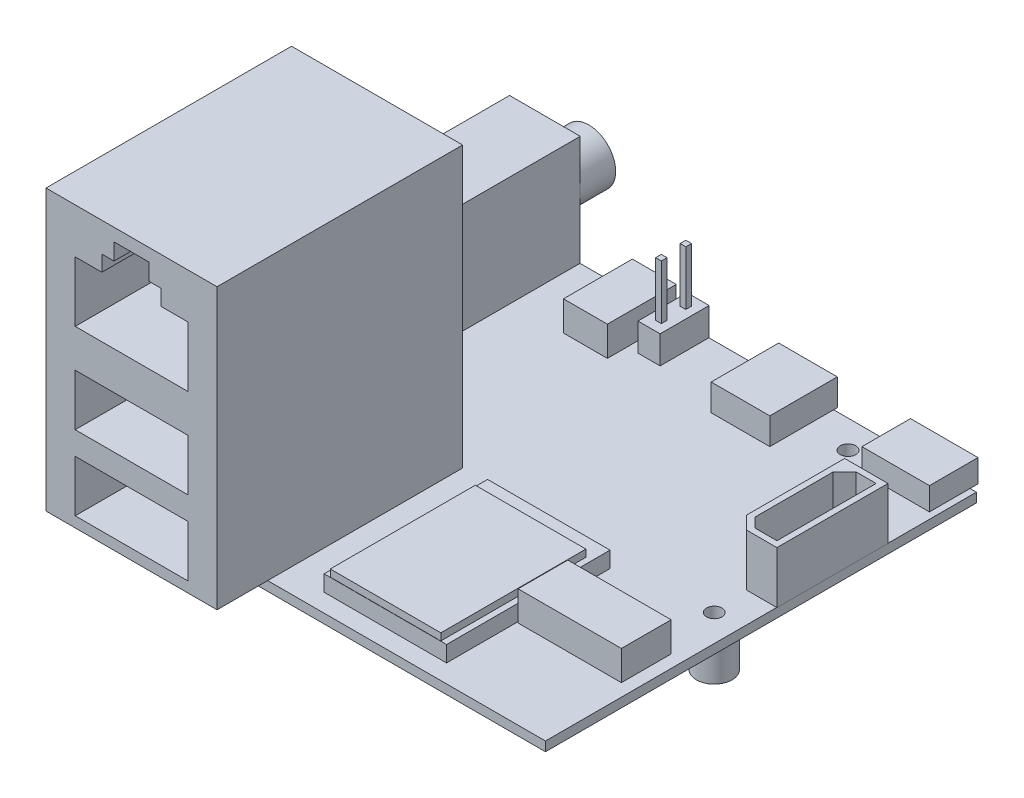
from build123d import *

# Parameters (mm, degrees)
SKETCH1_W                   = 52
SKETCH1_H                   = 48
BASE_DEPTH                  = 1.04
SKETCH3_W                   = 19.05
SKETCH3_H                   = 27.35
ETHERNET_USB_LINKPP_DEPTH   = 31.1658
SKETCH4_W                   = 12.5476
SKETCH4_H                   = 5.7404
USB_PORTS_DEPTH             = 8.89
ETHERNET_PORT_DEPTH         = 11.4681
SKETCH6_W                   = 7.874
SKETCH6_H                   = 13.97
HEADPHONE_JACK_DEPTH        = 12.2428
SKETCH7_R                   = 2.9972
SKETCH7_R_2                 = 1.7653
HEADPHONE_JACK_CIRCLE_DEPTH = 3.9751
SKETCH8_W                   = 4.8895
SKETCH8_H                   = 7.6708
DC_POWER_DEPTH              = 3.302
SKETCH9_R                   = 1.25
DC_POWER_HOLE_DEPTH         = 5.842
SKETCH10_R                  = 0.4
DC_POWER_PIN_DEPTH          = 4.1656
SKETCH11_W                  = 2.4638
SKETCH11_H                  = 5.461
PWM_PIN_BASE_DEPTH          = 3.0988
SKETCH12_W                  = 0.635
SKETCH12_H                  = 0.635
PWM_PINS_DEPTH              = 6.0452
SKETCH13_W                  = 6.5278
SKETCH13_H                  = 7.5184
MICRO_HDMI_PORT_DEPTH       = 2.9718
SKETCH14_W                  = 7.5184
SKETCH14_H                  = 5.4102
MICRO_USB_PORT_DEPTH        = 2.54
HEADER_HOLE_REACH           = 82.266
SKETCH15_R                  = 0.8636
SKETCH16_R                  = 1.9939
STANDOFFS_1_DEPTH           = 4.4704
SKETCH17_R                  = 1.9939
SHORT_STANDOFF_DEPTH        = 1.9939
THREADS_IN_STANDOFFS_REACH  = 82.266
SKETCH19_R                  = 0.8636
SKETCH20_W                  = 12.1158
SKETCH20_H                  = 12.1158
CPU_DEPTH                   = 1.4732
UART_PLASTIC_DEPTH          = 5.7912
UART_HOLE_DEPTH             = 4.1656
SKETCH23_W                  = 11.5062
SKETCH23_H                  = 5.5372
MICROSD_DEPTH               = 3.302
SKETCH24_W                  = 13.6398
SKETCH24_H                  = 18.2118
EMMC_BOARD_DEPTH            = 1.778
SKETCH25_W                  = 12.319
SKETCH25_H                  = 16.1544
EMMC_CHIP_DEPTH             = 0.7874


with BuildPart() as part:
    # Sketch1 → Base (new body)
    with BuildSketch(Plane(origin=(0, 0, 0), x_dir=(1, 0, 0), z_dir=(0, 1, 0))):
        with Locations((26, 24)):
            Rectangle(SKETCH1_W, SKETCH1_H)
    extrude(amount=BASE_DEPTH)

    # Sketch3 → Ethernet-USB-LinkPP (add)
    with BuildSketch(Plane(origin=(0, 1.04, 0), x_dir=(1, 0, 0), z_dir=(0, 1, 0))):
        with Locations((11.5316, 8.0362)):
            Rectangle(SKETCH3_W, SKETCH3_H)
    extrude(amount=ETHERNET_USB_LINKPP_DEPTH)

    # Sketch4 → USB ports (cut)
    with BuildSketch(Plane.XY.offset(5.6388)):
        with Locations((11.5316, 5.0786)):
            Rectangle(SKETCH4_W, SKETCH4_H)
        with Locations((11.5316, 13.3844)):
            Rectangle(SKETCH4_W, SKETCH4_H)
    extrude(amount=-USB_PORTS_DEPTH, mode=Mode.SUBTRACT)

    # Sketch5 → Ethernet port (cut)
    with BuildSketch(Plane.XY.offset(5.6388)):
        Polygon((5.2578, 27.1893), (8.2296, 27.1893), (8.2296, 28.9419), (9.5758, 28.9419), (9.5758, 30.7961), (13.4874, 30.7961), (13.4874, 28.9419), (14.8336, 28.9419), (14.8336, 27.1893), (17.8054, 27.1893), (17.8054, 20.4837), (5.2578, 20.4837), align=None)
    extrude(amount=-ETHERNET_PORT_DEPTH, mode=Mode.SUBTRACT)

    # Sketch6 → Headphone jack (add)
    with BuildSketch(Plane(origin=(0, 1.04, 0), x_dir=(1, 0, 0), z_dir=(0, 1, 0))):
        with Locations((3.9116, 41.0404)):
            Rectangle(SKETCH6_W, SKETCH6_H)
    extrude(amount=HEADPHONE_JACK_DEPTH)

    # Sketch7 → Headphone jack circle (add)
    with BuildSketch(Plane(origin=(0, 0, -48), x_dir=(-1, 0, 0), z_dir=(0, 0, -1))):
        with Locations(Location((-4.8514, 7.9107, 0), (0, 0, 180))):
            Circle(SKETCH7_R)
        with Locations(Location((-4.8514, 7.9107, 0), (0, 0, 180))):
            Circle(SKETCH7_R_2, mode=Mode.SUBTRACT)
    extrude(amount=HEADPHONE_JACK_CIRCLE_DEPTH)

    # Sketch8 → DC power (add)
    with BuildSketch(Plane(origin=(0, 1.04, 0), x_dir=(1, 0, 0), z_dir=(0, 1, 0))):
        with Locations((16.09725, 44.19)):
            Rectangle(SKETCH8_W, SKETCH8_H)
    extrude(amount=DC_POWER_DEPTH)

    # Sketch9 → DC power hole (cut)
    with BuildSketch(Plane(origin=(0, 0, -48.0254), x_dir=(-1, 0, 0), z_dir=(0, 0, -1))):
        with Locations((-16.09725, 2.3154)):
            Circle(SKETCH9_R)
    extrude(amount=-DC_POWER_HOLE_DEPTH, mode=Mode.SUBTRACT)

    # Sketch10 → DC power pin (add)
    with BuildSketch(Plane(origin=(0, 0, -42.1834), x_dir=(-1, 0, 0), z_dir=(0, 0, -1))):
        with Locations((-16.09725, 2.3154)):
            Circle(SKETCH10_R)
    extrude(amount=DC_POWER_PIN_DEPTH)

    # Sketch11 → PWM pin base (add)
    with BuildSketch(Plane(origin=(0, 1.04, 0), x_dir=(1, 0, 0), z_dir=(0, 1, 0))):
        with Locations((20.9739, 45.2949)):
            Rectangle(SKETCH11_W, SKETCH11_H)
    extrude(amount=PWM_PIN_BASE_DEPTH)

    # Sketch12 → PWM pins (add)
    with BuildSketch(Plane(origin=(0, 4.1388, 0), x_dir=(1, 0, 0), z_dir=(0, 1, 0))):
        with Locations((20.9739, 43.92965)):
            Rectangle(SKETCH12_W, SKETCH12_H)
        with Locations((20.9739, 46.66015)):
            Rectangle(SKETCH12_W, SKETCH12_H)
    extrude(amount=PWM_PINS_DEPTH)

    # Sketch13 → Micro HDMI port (add)
    with BuildSketch(Plane(origin=(0, 1.04, 0), x_dir=(1, 0, 0), z_dir=(0, 1, 0))):
        with Locations((32.8357, 44.6472)):
            Rectangle(SKETCH13_W, SKETCH13_H)
    extrude(amount=MICRO_HDMI_PORT_DEPTH)

    # Sketch14 → Micro USB port (add)
    with BuildSketch(Plane(origin=(0, 1.04, 0), x_dir=(1, 0, 0), z_dir=(0, 1, 0))):
        with Locations((47.5296, 46.1839)):
            Rectangle(SKETCH14_W, SKETCH14_H)
    extrude(amount=MICRO_USB_PORT_DEPTH)

    # Sketch15 → Header hole (cut, up to next)
    with BuildSketch(Plane(origin=(0, 0, 0), x_dir=(-1, 0, 0), z_dir=(0, -1, 0)), mode=Mode.PRIVATE) as header_hole_sk1:
        with Locations(Location((-3, 30.1, 0), (0, 0, 90))):
            Circle(SKETCH15_R)
    header_hole_tool1 = extrude(header_hole_sk1.sketch, amount=-HEADER_HOLE_REACH, mode=Mode.PRIVATE) & part.part
    # Sketch15 → Header hole (cut, up to next)
    with BuildSketch(Plane(origin=(0, 0, 0), x_dir=(-1, 0, 0), z_dir=(0, -1, 0)), mode=Mode.PRIVATE) as header_hole_sk2:
        with Locations(Location((-49, 21.8012, 0), (0, 0, 90))):
            Circle(SKETCH15_R)
    header_hole_tool2 = extrude(header_hole_sk2.sketch, amount=-HEADER_HOLE_REACH, mode=Mode.PRIVATE) & part.part
    # Sketch15 → Header hole (cut, up to next)
    with BuildSketch(Plane(origin=(0, 0, 0), x_dir=(-1, 0, 0), z_dir=(0, -1, 0)), mode=Mode.PRIVATE) as header_hole_sk3:
        with Locations(Location((-40.8, 44.9012, 0), (0, 0, 90))):
            Circle(SKETCH15_R)
    header_hole_tool3 = extrude(header_hole_sk3.sketch, amount=-HEADER_HOLE_REACH, mode=Mode.PRIVATE) & part.part
    add(header_hole_tool1.solids().sort_by_distance((3, 0, -30.1))[0], mode=Mode.SUBTRACT)
    add(header_hole_tool2.solids().sort_by_distance((49, 0, -21.8012))[0], mode=Mode.SUBTRACT)
    add(header_hole_tool3.solids().sort_by_distance((40.8, 0, -44.9012))[0], mode=Mode.SUBTRACT)

    # Sketch16 → Standoffs 1 (add)
    with BuildSketch(Plane.XZ):
        with Locations(Location((49, -21.8012, 0), (0, 0, 270))):
            Circle(SKETCH16_R)
        with Locations(Location((3, -30.1, 0), (0, 0, 270))):
            Circle(SKETCH16_R)
    extrude(amount=STANDOFFS_1_DEPTH)

    # Sketch17 → Short standoff (add)
    with BuildSketch(Plane.XZ):
        with Locations(Location((40.8, -44.9012, 0), (0, 0, 270))):
            Circle(SKETCH17_R)
    extrude(amount=SHORT_STANDOFF_DEPTH)

    # Sketch19 → Threads in standoffs (cut, up to next)
    with BuildSketch(Plane.XZ, mode=Mode.PRIVATE) as threads_in_standoffs_sk1:
        with Locations(Location((40.8, -44.9012, 0), (0, 0, 270))):
            Circle(SKETCH19_R)
    threads_in_standoffs_tool1 = extrude(threads_in_standoffs_sk1.sketch, amount=THREADS_IN_STANDOFFS_REACH, mode=Mode.PRIVATE) & part.part
    # Sketch19 → Threads in standoffs (cut, up to next)
    with BuildSketch(Plane.XZ, mode=Mode.PRIVATE) as threads_in_standoffs_sk2:
        with Locations(Location((49, -21.8012, 0), (0, 0, 270))):
            Circle(SKETCH19_R)
    threads_in_standoffs_tool2 = extrude(threads_in_standoffs_sk2.sketch, amount=THREADS_IN_STANDOFFS_REACH, mode=Mode.PRIVATE) & part.part
    # Sketch19 → Threads in standoffs (cut, up to next)
    with BuildSketch(Plane.XZ, mode=Mode.PRIVATE) as threads_in_standoffs_sk3:
        with Locations(Location((3, -30.1, 0), (0, 0, 270))):
            Circle(SKETCH19_R)
    threads_in_standoffs_tool3 = extrude(threads_in_standoffs_sk3.sketch, amount=THREADS_IN_STANDOFFS_REACH, mode=Mode.PRIVATE) & part.part
    add(threads_in_standoffs_tool1.solids().sort_by_distance((40.8, 0, -44.9012))[0], mode=Mode.SUBTRACT)
    add(threads_in_standoffs_tool2.solids().sort_by_distance((49, 0, -21.8012))[0], mode=Mode.SUBTRACT)
    add(threads_in_standoffs_tool3.solids().sort_by_distance((3, 0, -30.1))[0], mode=Mode.SUBTRACT)

    # Sketch20 → CPU (add)
    with BuildSketch(Plane(origin=(0, 0, 0), x_dir=(-1, 0, 0), z_dir=(0, -1, 0))):
        with Locations((-37.8141, 31.1979)):
            Rectangle(SKETCH20_W, SKETCH20_H)
    extrude(amount=CPU_DEPTH)

    # Sketch21 → UART plastic (add)
    with BuildSketch(Plane(origin=(0, 1.04, 0), x_dir=(1, 0, 0), z_dir=(0, 1, 0))):
        Polygon((52.0254, 38.1254), (47.1994, 38.1254), (47.1994, 27.192440979), (48.636240979, 25.7556), (52.0254, 25.7556), align=None)
    extrude(amount=UART_PLASTIC_DEPTH)

    # Sketch22 → UART hole (cut)
    with BuildSketch(Plane(origin=(0, 6.8312, 0), x_dir=(1, 0, 0), z_dir=(0, 1, 0))):
        Polygon((51.365, 37.465), (49.134996369, 37.465), (47.8598, 36.189803631), (47.8598, 27.465987616), (48.909787616, 26.416), (51.365, 26.416), align=None)
    extrude(amount=-UART_HOLE_DEPTH, mode=Mode.SUBTRACT)

    # Sketch23 → MicroSD (add)
    with BuildSketch(Plane(origin=(0, 1.04, 0), x_dir=(1, 0, 0), z_dir=(0, 1, 0))):
        with Locations((44.8499, 12.6238)):
            Rectangle(SKETCH23_W, SKETCH23_H)
    extrude(amount=MICROSD_DEPTH)

    # Sketch24 → eMMC board (add)
    with BuildSketch(Plane(origin=(0, 1.04, 0), x_dir=(1, 0, 0), z_dir=(0, 1, 0))):
        with Locations((32.1437, 11.1252)):
            Rectangle(SKETCH24_W, SKETCH24_H)
    extrude(amount=EMMC_BOARD_DEPTH)

    # Sketch25 → eMMC chip (add)
    with BuildSketch(Plane(origin=(0, 2.818, 0), x_dir=(1, 0, 0), z_dir=(0, 1, 0))):
        with Locations((32.1437, 10.1219)):
            Rectangle(SKETCH25_W, SKETCH25_H)
    extrude(amount=EMMC_CHIP_DEPTH)


solid = part.part
